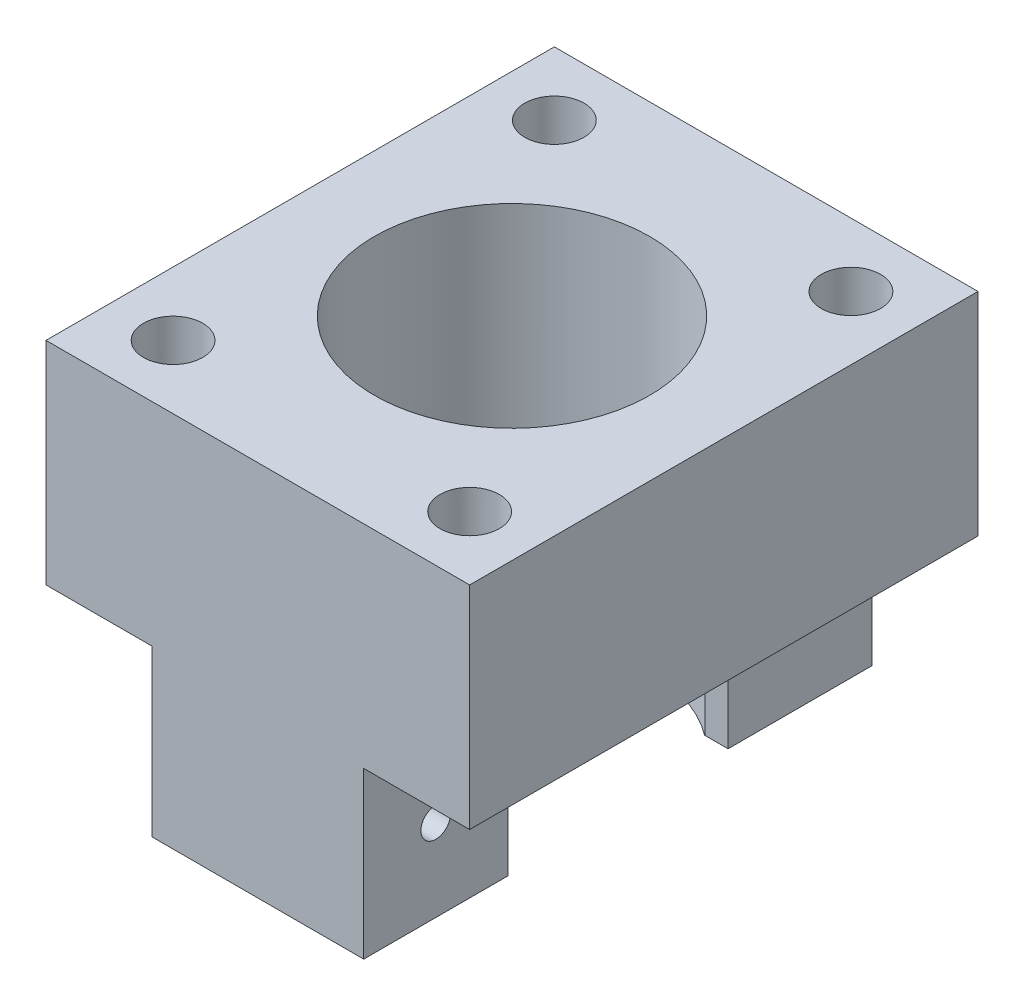
from build123d import *
from build123d.topology import SkipClean

# Parameters (mm, degrees)
SKETCH_1_W          = 10
SKETCH_1_H          = 12
EXTRUDE_1_DEPTH     = 5
SKETCH_2_R          = 0.7
CUT_EXTRUDE_1_DEPTH = 17.401219467
SKETCH_2_3_R        = 3.25
CUT_EXTRUDE_2_DEPTH = 17.401219467
SKETCH_2_4_R        = 1
CUT_EXTRUDE_3_DEPTH = 3
EXTRUDE_START       = 3.9
EXTRUDE_2_DEPTH     = 3.9
SKETCH_4_R          = 0.35
CUT_EXTRUDE_4_DEPTH = 16.00833102


with BuildPart() as part:
    # 草图1 → 凸台-拉伸1 (new body)
    with BuildSketch(Plane(origin=(0, 0, 0), x_dir=(1, 0, 0), z_dir=(0, 1, 0))):
        with Locations((5, -6)):
            Rectangle(SKETCH_1_W, SKETCH_1_H)
    extrude(amount=EXTRUDE_1_DEPTH)

    # 草图2 → 切除-拉伸1 (cut, through all)
    with BuildSketch(Plane.XZ):
        with Locations(Location((1.5, 1.5, 0), (0, 0, 270))):
            Circle(SKETCH_2_R)
        with Locations(Location((1.5, 10.5, 0), (0, 0, 270))):
            Circle(SKETCH_2_R)
        with Locations(Location((8.5, 10.5, 0), (0, 0, 270))):
            Circle(SKETCH_2_R)
        with Locations(Location((8.5, 1.5, 0), (0, 0, 270))):
            Circle(SKETCH_2_R)
    extrude(amount=-CUT_EXTRUDE_1_DEPTH, mode=Mode.SUBTRACT)

    # 草图2<3> → 切除-拉伸2 (cut, through all)
    with BuildSketch(Plane.XZ):
        with Locations(Location((5, 6, 0), (0, 0, 270))):
            Circle(SKETCH_2_3_R)
    extrude(amount=-CUT_EXTRUDE_2_DEPTH, mode=Mode.SUBTRACT)

    # 草图2<4> → 切除-拉伸3 (cut)
    with BuildSketch(Plane.XZ):
        with Locations(Location((1.5, 10.5, 0), (0, 0, 270))):
            Circle(SKETCH_2_4_R)
        with Locations(Location((8.5, 10.5, 0), (0, 0, 270))):
            Circle(SKETCH_2_4_R)
        with Locations(Location((8.5, 1.5, 0), (0, 0, 270))):
            Circle(SKETCH_2_4_R)
        with Locations(Location((1.5, 1.5, 0), (0, 0, 270))):
            Circle(SKETCH_2_4_R)
    extrude(amount=-CUT_EXTRUDE_3_DEPTH, mode=Mode.SUBTRACT)

    # 草图3 → 凸台-拉伸2 (add)
    with SkipClean():  # the faces are left unmerged after this step: merging them gives an invalid solid
        with BuildSketch(Plane.XZ.offset(EXTRUDE_START)):
            with BuildLine():
                Line((2.5, 8.6), (3.05, 8.6))
                ThreePointArc((3.05, 8.6), (5, 9.25), (6.95, 8.6))
                Line((6.95, 8.6), (7.5, 8.6))
                Line((7.5, 8.6), (7.5, 12))
                Line((7.5, 12), (2.5, 12))
                Line((2.5, 12), (2.5, 8.6))
            make_face()
            with BuildLine():
                Line((2.5, 3.4), (2.5, 0))
                Line((2.5, 0), (7.5, 0))
                Line((7.5, 0), (7.5, 3.4))
                Line((7.5, 3.4), (6.95, 3.4))
                ThreePointArc((6.95, 3.4), (5, 2.75), (3.05, 3.4))
                Line((3.05, 3.4), (2.5, 3.4))
            make_face()
        extrude(amount=-EXTRUDE_2_DEPTH)

    # 草图4 → 切除-拉伸4 (cut, through all)
    with SkipClean():  # the faces are left unmerged after this step: merging them gives an invalid solid
        with BuildSketch(Plane.ZY.offset(-2.5)):
            with Locations((10.3, -1.95)):
                Circle(SKETCH_4_R)
            with Locations((1.7, -1.95)):
                Circle(SKETCH_4_R)
        extrude(amount=-CUT_EXTRUDE_4_DEPTH, mode=Mode.SUBTRACT)


solid = part.part
